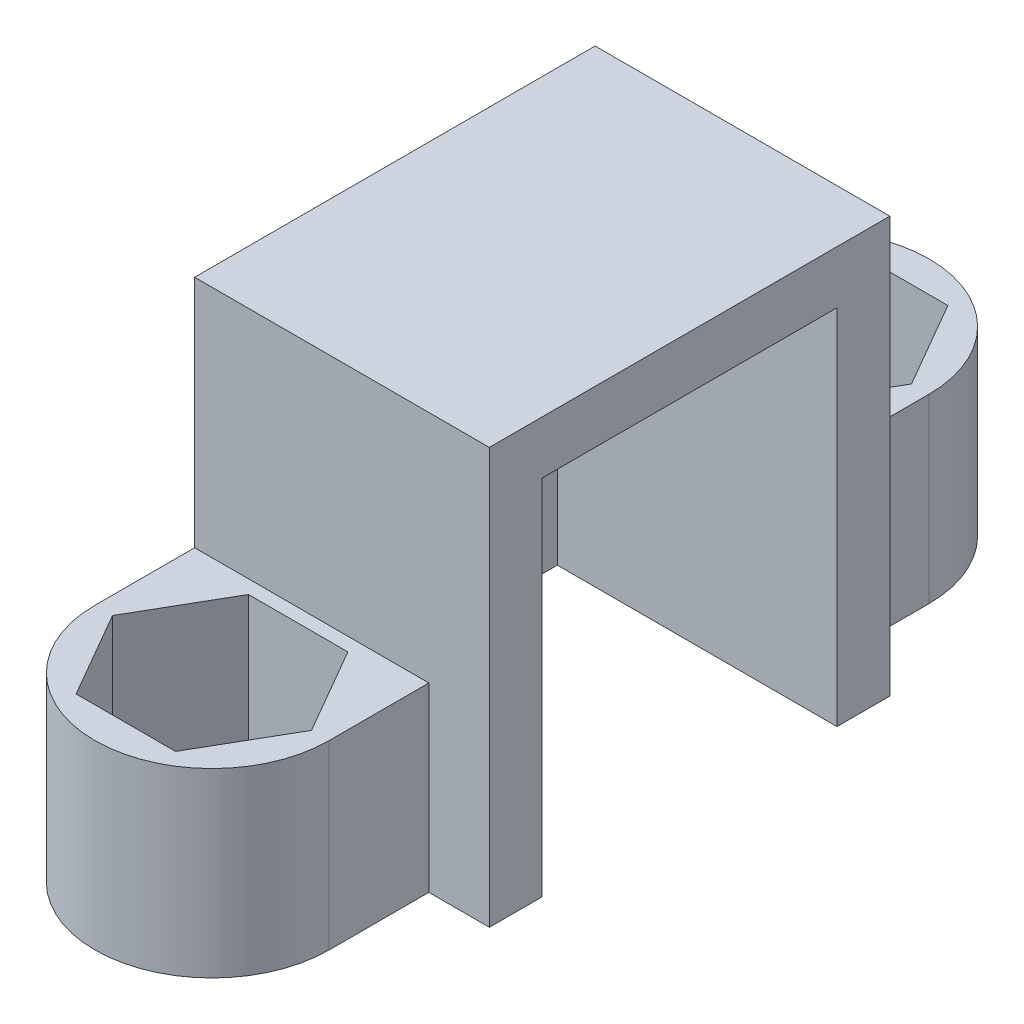
from build123d import *

# Parameters (mm, degrees)
BOSS_EXTRUDE1_DEPTH = 9.75
BOSS_EXTRUDE2_START = -1
BOSS_EXTRUDE2_DEPTH = 5
BOSS_EXTRUDE3_START = 1
SKETCH3_R           = 1.6
BOSS_EXTRUDE3_DEPTH = 1
BOSS_EXTRUDE4_DEPTH = 0.5


with BuildPart() as part:
    # Sketch1 → Boss-Extrude1 (new body)
    with BuildSketch(Plane(origin=(0, 0, 0), x_dir=(0, 0, -1), z_dir=(1, 0, 0))):
        Polygon((-4.875, -6.875), (-4.875, 5.125), (4.875, 5.125), (4.875, -6.875), (6.625, -6.875), (6.625, 6.875), (-6.625, 6.875), (-6.625, -6.875), align=None)
    extrude(amount=BOSS_EXTRUDE1_DEPTH)

    # Sketch2 → Boss-Extrude2 (add)
    with BuildSketch(Plane.XZ.offset(6.875).offset(BOSS_EXTRUDE2_START)):
        with BuildLine():
            Line((0, 9.925), (0, 4.875))
            Line((0, 4.875), (7.75, 4.875))
            Line((7.75, 4.875), (7.75, 9.925))
            ThreePointArc((7.75, 9.925), (3.875, 13.8), (0, 9.925))
        make_face()
        Polygon((0.584103466, 9.925), (2.229551733, 12.775), (5.520448267, 12.775), (7.165896534, 9.925), (5.520448267, 7.075), (2.229551733, 7.075), align=None, mode=Mode.SUBTRACT)
    boss_extrude2 = extrude(amount=-BOSS_EXTRUDE2_DEPTH)

    # Sketch3 → Boss-Extrude3 (add)
    with BuildSketch(Plane.XZ.offset(5.875).offset(BOSS_EXTRUDE3_START)):
        with BuildLine():
            Line((7.75, 6.625), (7.75, 9.925))
            ThreePointArc((7.75, 9.925), (3.875, 13.8), (0, 9.925))
            Line((0, 9.925), (0, 6.625))
            Line((0, 6.625), (7.75, 6.625))
        make_face()
        with Locations(Location((3.875, 9.925, 0), (0, 0, 90))):
            Circle(SKETCH3_R, mode=Mode.SUBTRACT)
    boss_extrude3 = extrude(amount=-BOSS_EXTRUDE3_DEPTH)

    # Mirror1: Boss-Extrude2, Boss-Extrude3 across plane
    add(boss_extrude2.mirror(Plane.XY))
    add(boss_extrude3.mirror(Plane.XY))

    # Sketch4 → Boss-Extrude4 (add)
    with BuildSketch(Plane.ZY):
        Polygon((-6.625, 6.875), (-6.625, -6.875), (-4.375, -6.875), (-4.375, 4.625), (4.375, 4.625), (4.375, -6.875), (6.625, -6.875), (6.625, 6.875), align=None)
    extrude(amount=-BOSS_EXTRUDE4_DEPTH)


solid = part.part
